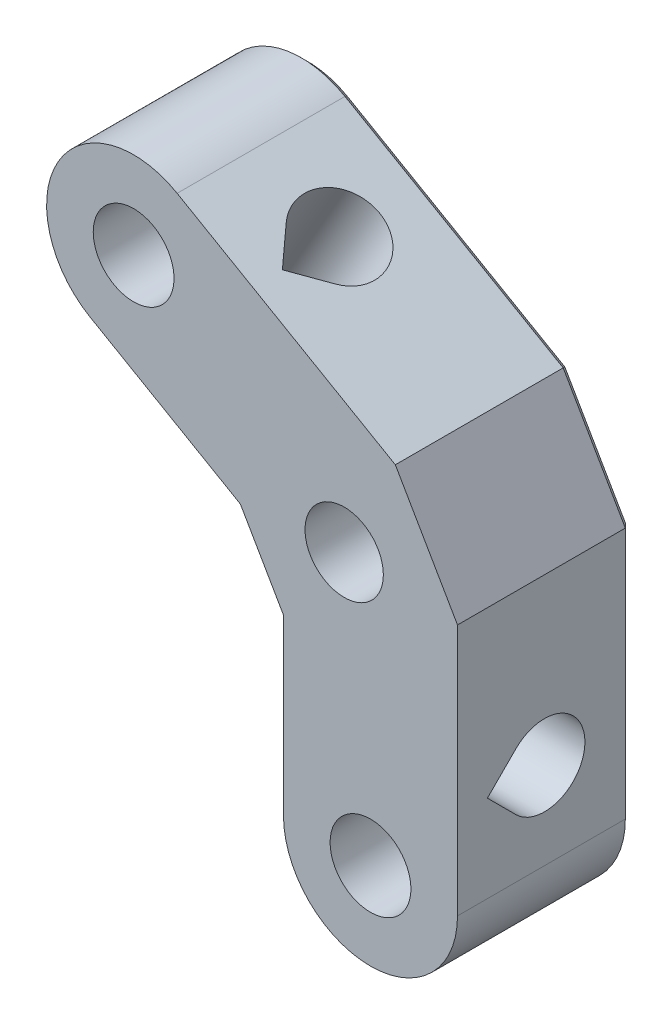
from build123d import *

# Parameters (mm, degrees)
BOSS_EXTRUDE1_DEPTH = 14
HOLE1_D             = 6.5
HOLE2_D             = 6.5
CUT_EXTRUDE1_DEPTH  = 46.814563472
CUT_EXTRUDE2_DEPTH  = 47.465040622
SKETCH8_R           = 3.15
CUT_EXTRUDE3_DEPTH  = 50.746716719
CHAMFER1_SIZE       = 0.5


with BuildPart() as part:
    # Sketch1 → Boss-Extrude1 (new body)
    with BuildSketch(Plane.XY.offset(14)):
        with BuildLine():
            Line((7, 0), (7, 20.267949192))
            Line((7, 20.267949192), (2, 28.92820323))
            Line((2, 28.92820323), (-15.552558883, 39.062177826))
            ThreePointArc((-15.552558883, 39.062177826), (-25.11473671, 36.5), (-22.552558883, 26.937822174))
            Line((-22.552558883, 26.937822174), (-10.464101615, 19.958548116))
            Line((-10.464101615, 19.958548116), (-7, 13.958548116))
            Line((-7, 13.958548116), (-7, 0))
            ThreePointArc((-7, 0), (0, -7), (7, 0))
        make_face()
    extrude(amount=-BOSS_EXTRUDE1_DEPTH)

    # Hole1 (through all)
    with Locations(Plane(origin=(0, 0, 0), x_dir=(-1, 0, 0), z_dir=(0, 0, -1))):
        with Locations((0, 0)):
            Hole(HOLE1_D / 2)

    # Hole2 (through all)
    with Locations(Plane(origin=(0, 0, 0), x_dir=(-1, 0, 0), z_dir=(0, 0, -1))):
        with Locations((19.0525, 32.999898011)):
            Hole(HOLE2_D / 2)

    # Sketch2 → Cut-Extrude1 (cut, through all)
    with BuildSketch(Plane(origin=(6.026279442, 10.437822174, 0), x_dir=(0.8660254037844398, -0.49999999999999806, 0), z_dir=(-0.499999999999998, -0.8660254037844397, 0))):
        with BuildLine():
            Line((-25.999898011, 11.596194078), (-28.29799505, 9.298097039))
            ThreePointArc((-28.29799505, 9.298097039), (-25.999898011, 3.75), (-23.701800972, 9.298097039))
            Line((-23.701800972, 9.298097039), (-25.999898011, 11.596194078))
        make_face()
    extrude(amount=-CUT_EXTRUDE1_DEPTH, mode=Mode.SUBTRACT)

    # Sketch3 → Cut-Extrude2 (cut, through all)
    with BuildSketch(Plane.ZY.offset(7)):
        with BuildLine():
            Line((9.298097039, 4.701902961), (11.596194078, 7))
            Line((11.596194078, 7), (9.298097039, 9.298097039))
            ThreePointArc((9.298097039, 9.298097039), (3.75, 7), (9.298097039, 4.701902961))
        make_face()
    extrude(amount=-CUT_EXTRUDE2_DEPTH, mode=Mode.SUBTRACT)

    # Sketch8 → Cut-Extrude3 (cut, through all)
    with BuildSketch(Plane.XY.offset(14)):
        with Locations((-2.116025404, 20.778312164)):
            Circle(SKETCH8_R)
    extrude(amount=-CUT_EXTRUDE3_DEPTH, mode=Mode.SUBTRACT)

    # Chamfer1
    chamfer1_edges = [part.edges().sort_by_distance(p)[0] for p in [
        (-3.25, 0, 0),
        (-5.266025404, 20.778312164, 0),
        (-22.3025, 32.999898011, 0),
        (4.5, 24.598076211, 0),
        (7, 10.133974596, 0),
        (0, -7, 0),
        (-7, 6.979274058, 0),
        (-8.732050808, 16.958548116, 0),
        (-16.508330249, 23.448185145, 0),
        (-25.11473671, 36.5, 0),
        (-6.776279442, 33.995190528, 0),
    ]]
    chamfer(chamfer1_edges, length=CHAMFER1_SIZE)


solid = part.part
